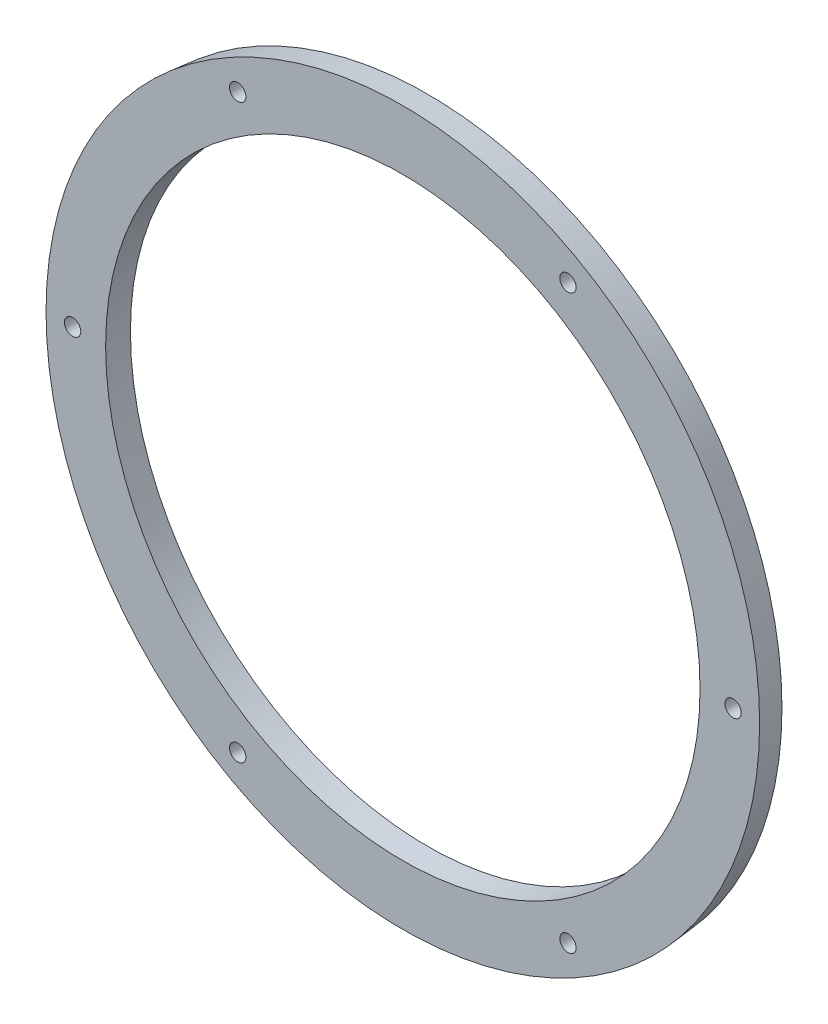
from build123d import *

# Parameters (mm, degrees)
SKETCH1_R           = 71.85
SKETCH1_R_2         = 59.85
SKETCH1_R_3         = 1.65
BOSS_EXTRUDE1_DEPTH = 5


with BuildPart() as part:
    # Sketch1 → Boss-Extrude1 (new body)
    with BuildSketch(Plane.XY):
        Circle(SKETCH1_R)
        Circle(SKETCH1_R_2, mode=Mode.SUBTRACT)
        with Locations((66.5, 0)):
            Circle(SKETCH1_R_3, mode=Mode.SUBTRACT)
        with Locations((33.25, -57.590689352)):
            Circle(SKETCH1_R_3, mode=Mode.SUBTRACT)
        with Locations((-33.25, -57.590689352)):
            Circle(SKETCH1_R_3, mode=Mode.SUBTRACT)
        with Locations((-66.5, 0)):
            Circle(SKETCH1_R_3, mode=Mode.SUBTRACT)
        with Locations((-33.25, 57.590689352)):
            Circle(SKETCH1_R_3, mode=Mode.SUBTRACT)
        with Locations((33.25, 57.590689352)):
            Circle(SKETCH1_R_3, mode=Mode.SUBTRACT)
    extrude(amount=BOSS_EXTRUDE1_DEPTH)

    # Sketch2 → Cut-Revolve1 (revolve, cut)
    with BuildSketch(Plane(origin=(0, 0, 0), x_dir=(1, 0, 0), z_dir=(0, 1, 0)), mode=Mode.PRIVATE) as cut_revolve1_sk:
        Polygon((71.35, 0), (71.85, 0), (71.85, -5), align=None)
    revolve(cut_revolve1_sk.sketch.rotate(Axis((0, 0, 0), (0, 0, 1)), 180), axis=Axis((0, 0, 0), (0, 0, 1)), mode=Mode.SUBTRACT)


solid = part.part
